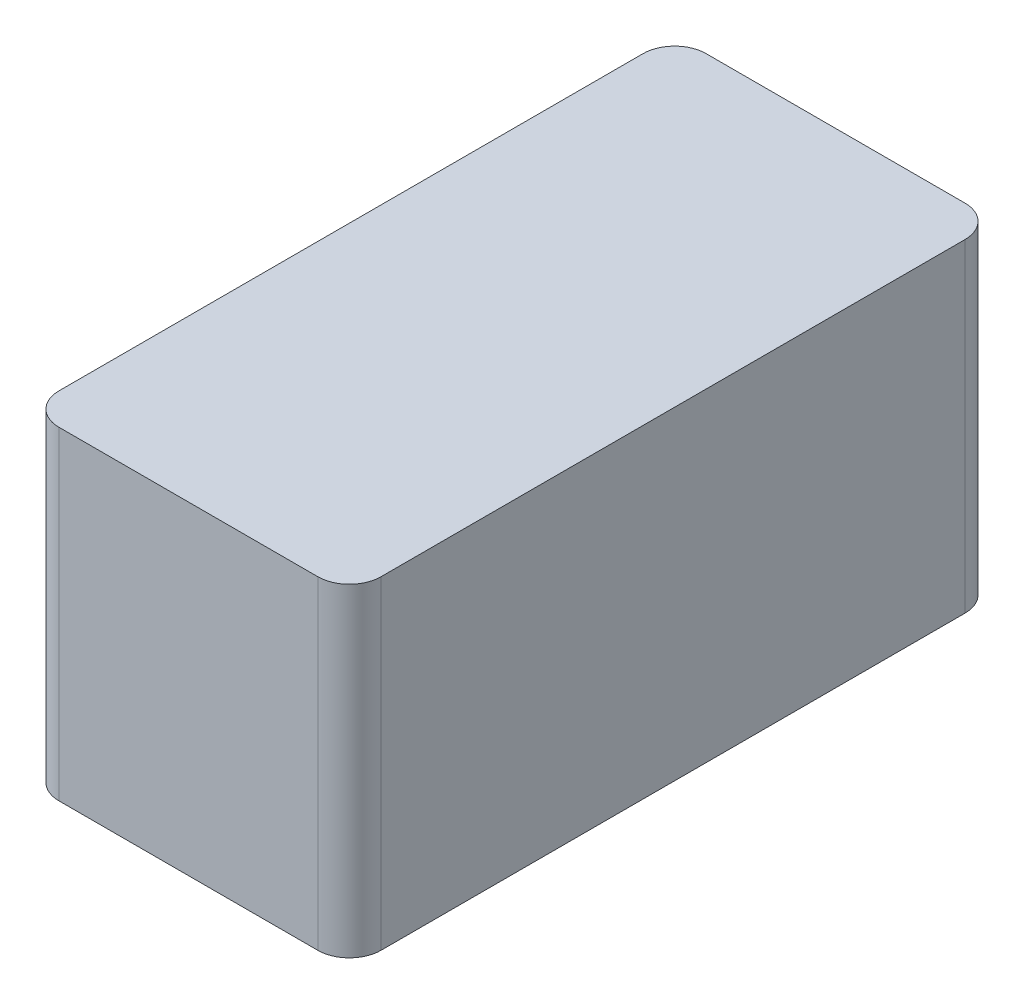
from build123d import *

# Parameters (mm, degrees)
SKETCH1_W           = 20.4
SKETCH1_H           = 41
BOSS_EXTRUDE1_DEPTH = 10.25
FILLET1_R           = 2


with BuildPart() as part:
    # Sketch1 → Boss-Extrude1 (new, symmetric)
    with BuildSketch(Plane(origin=(0, 0, 0), x_dir=(1, 0, 0), z_dir=(0, 1, 0))):
        Rectangle(SKETCH1_W, SKETCH1_H)
    extrude(amount=BOSS_EXTRUDE1_DEPTH, both=True)

    # Fillet1
    fillet1_edges = [part.edges().sort_by_distance(p)[0] for p in [
        (10.2, 0, 20.5),
        (-10.2, 0, 20.5),
        (-10.2, 0, -20.5),
        (10.2, 0, -20.5),
    ]]
    fillet(fillet1_edges, radius=FILLET1_R)


solid = part.part
